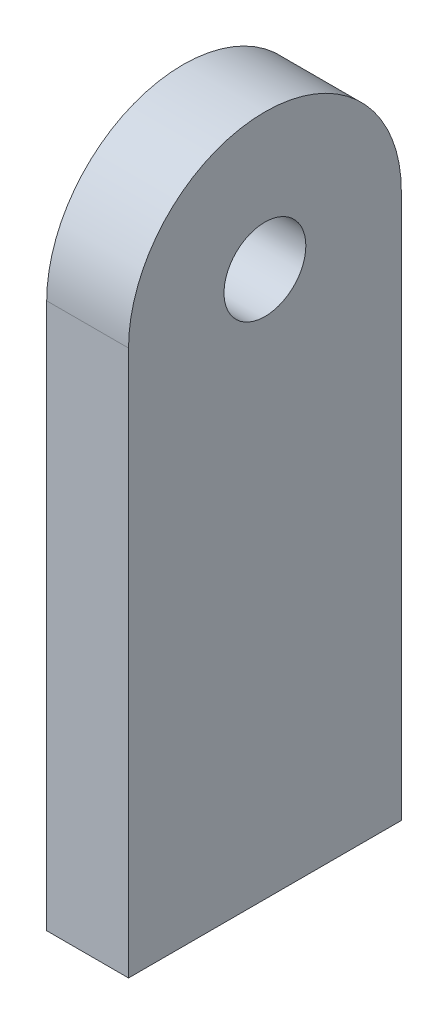
from build123d import *

# Parameters (mm, degrees)
SKETCH1_R           = 3
BOSS_EXTRUDE1_DEPTH = 6


with BuildPart() as part:
    # Sketch1 → Boss-Extrude1 (new body)
    with BuildSketch(Plane(origin=(0, 0, 0), x_dir=(0, 0, -1), z_dir=(1, 0, 0))):
        with BuildLine():
            Line((20, 40), (20, 0))
            Line((20, 0), (0, 0))
            Line((0, 0), (0, 40))
            ThreePointArc((0, 40), (10, 50), (20, 40))
        make_face()
        with Locations((10, 40)):
            Circle(SKETCH1_R, mode=Mode.SUBTRACT)
    extrude(amount=BOSS_EXTRUDE1_DEPTH)


solid = part.part
